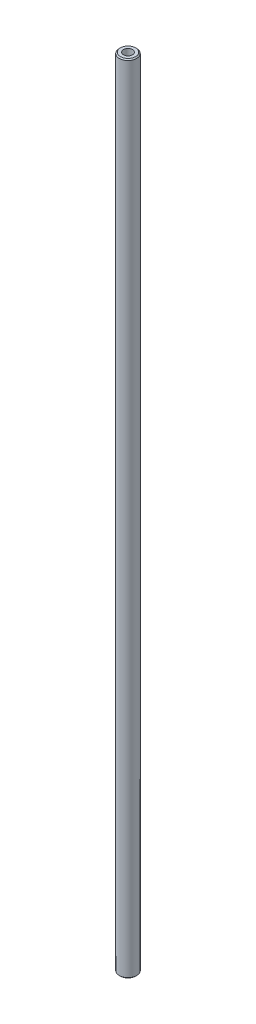
from build123d import *

# Parameters (mm, degrees)
ESBO_O3_R                = 4
RESSALTO_EXTRUS_O1_DEPTH = 183.5
CHANFRO1_SIZE            = 0.5


with BuildPart() as part:
    # Esboço3 → Ressalto-extrusão1 (new, symmetric)
    with BuildSketch(Plane(origin=(0, 0, 0), x_dir=(1, 0, 0), z_dir=(0, 1, 0))):
        with Locations(Location((0, 0, 0), (0, 0, 270))):
            Circle(ESBO_O3_R)
    extrude(amount=RESSALTO_EXTRUS_O1_DEPTH, both=True)

    # Chanfro1
    chanfro1_edges = [part.edges().sort_by_distance(p)[0] for p in [
        (0, -183.5, -4),
        (0, 183.5, -4),
    ]]
    chamfer(chanfro1_edges, length=CHANFRO1_SIZE)

    # Esboço4 → Furo roscado de M51 (revolve, cut)
    with BuildSketch(Plane(origin=(0, 183.5, 0), x_dir=(0, 0, 1), z_dir=(1, 0, 0))):
        Polygon((0, 0), (0, 25.2618073), (2.1, 24), (2.1, 0), align=None)
    furo_roscado_de_m51 = revolve(axis=Axis((0, 189.85, 0), (0, -1, 0)), mode=Mode.SUBTRACT)

    # Espelhar1: Furo roscado de M51 across plane
    add(furo_roscado_de_m51.mirror(Plane.ZX), mode=Mode.SUBTRACT)


solid = part.part
